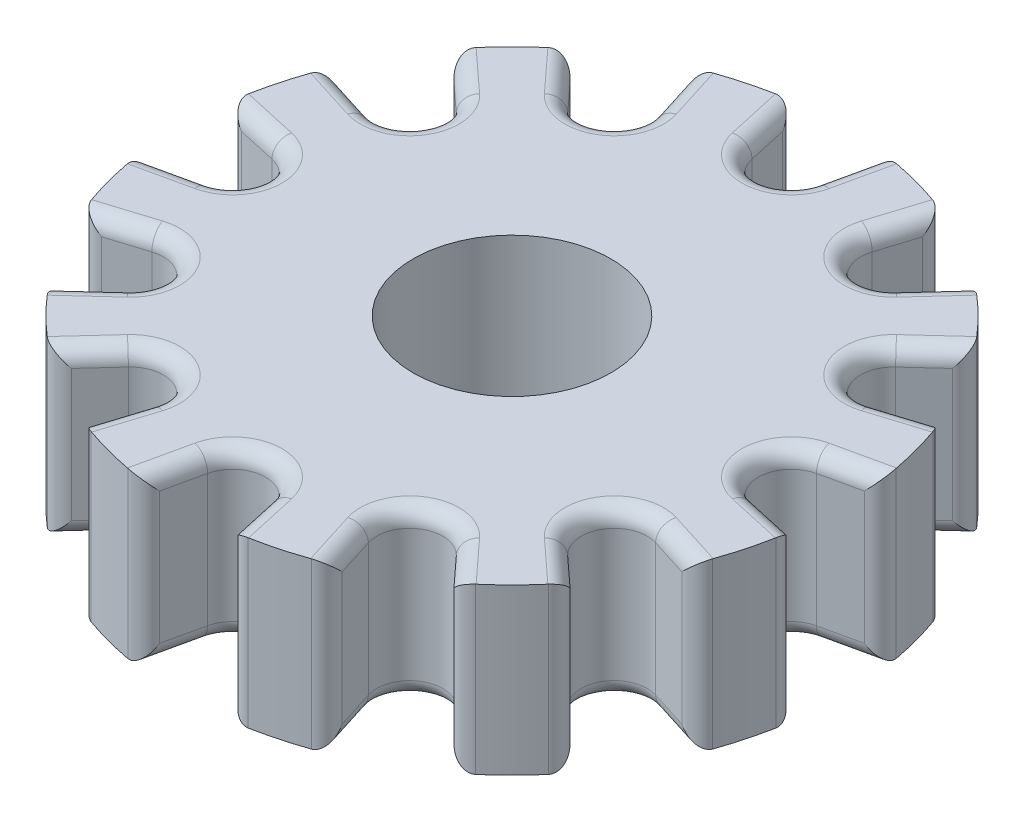
from build123d import *

# Parameters (mm, degrees)
SKETCH2_R                = 20
BOSS_EXTRUDE2_DEPTH      = 5
SKETCH4_R                = 6
CUT_EXTRUDE3_DEPTH       = 10
CUT_EXTRUDE5_DEPTH       = 10
FILLET1_R                = 1
CIRPATTERN3_COUNT        = 12
FILLET1_OF_CIRPATTERN3_R = 1


with BuildPart() as part:
    # Sketch2 → Boss-Extrude2 (new, symmetric)
    with BuildSketch(Plane(origin=(0, 0, 0), x_dir=(1, 0, 0), z_dir=(0, 1, 0))):
        with Locations(Location((0, 0, 0), (0, 0, 270))):
            Circle(SKETCH2_R)
    extrude(amount=BOSS_EXTRUDE2_DEPTH, both=True)

    # Sketch4 → Cut-Extrude3 (cut)
    with BuildSketch(Plane(origin=(0, 5, 0), x_dir=(1, 0, 0), z_dir=(0, 1, 0))):
        with Locations(Location((0, 0, 0), (0, 0, 270))):
            Circle(SKETCH4_R)
    extrude(amount=-CUT_EXTRUDE3_DEPTH, mode=Mode.SUBTRACT)

    # Sketch3 → Cut-Extrude5 (cut)
    with BuildSketch(Plane(origin=(0, 5, 0), x_dir=(1, 0, 0), z_dir=(0, 1, 0))):
        with BuildLine():
            Line((1.952478146, 16.518952502), (2.684980769, 19.818952502))
            ThreePointArc((2.684980769, 19.818952502), (0, 20), (-2.684980769, 19.818952502))
            Line((-2.684980769, 19.818952502), (-1.952478146, 16.518952502))
            ThreePointArc((-1.952478146, 16.518952502), (0, 14.952345036), (1.952478146, 16.518952502))
        make_face()
    cut_extrude5 = extrude(amount=-CUT_EXTRUDE5_DEPTH, mode=Mode.SUBTRACT)

    # Fillet1
    fillet1_edges = [part.edges().sort_by_distance(p)[0] for p in [
        (-2.684980769, 0, -19.818952502),
        (2.318729458, -5, -18.168952502),
        (2.684980769, 0, -19.818952502),
        (0, -5, -14.952345036),
        (-2.318729458, -5, -18.168952502),
        (-2.318729458, 5, -18.168952502),
        (0, 5, -14.952345036),
        (2.318729458, 5, -18.168952502),
    ]]
    fillet(fillet1_edges, radius=FILLET1_R)

    # CirPattern3: Cut-Extrude5 ×12 about axis
    cirpattern3_axis = Axis((0, 0, 0), (0, 1, 0))
    for i in range(1, CIRPATTERN3_COUNT):
        add(cut_extrude5.rotate(cirpattern3_axis, i * 360 / CIRPATTERN3_COUNT), mode=Mode.SUBTRACT)

    # Fillet1 of CirPattern3
    fillet1_of_cirpattern3_edges = [part.edges().sort_by_distance(p)[0] for p in [
        (-12.234737806, 0, -15.821225958),
        (-7.076397636, -5, -16.894139156),
        (-7.584214696, 0, -18.506206728),
        (-7.476172518, -5, -12.949110648),
        (-11.092554866, -5, -14.575409698),
        (-11.092554866, 5, -14.575409698),
        (-7.476172518, 5, -12.949110648),
        (-7.076397636, 5, -16.894139156),
        (-18.506206728, 0, -7.584214696),
        (-14.575409698, -5, -11.092554866),
        (-15.821225958, 0, -12.234737806),
        (-12.949110648, -5, -7.476172518),
        (-16.894139156, -5, -7.076397636),
        (-16.894139156, 5, -7.076397636),
        (-12.949110648, 5, -7.476172518),
        (-14.575409698, 5, -11.092554866),
        (-19.818952502, 0, 2.684980769),
        (-18.168952502, -5, -2.318729458),
        (-19.818952502, 0, -2.684980769),
        (-14.952345036, -5, 0),
        (-18.168952502, -5, 2.318729458),
        (-18.168952502, 5, 2.318729458),
        (-14.952345036, 5, 0),
        (-18.168952502, 5, -2.318729458),
        (-15.821225958, 0, 12.234737806),
        (-16.894139156, -5, 7.076397636),
        (-18.506206728, 0, 7.584214696),
        (-12.949110648, -5, 7.476172518),
        (-14.575409698, -5, 11.092554866),
        (-14.575409698, 5, 11.092554866),
        (-12.949110648, 5, 7.476172518),
        (-16.894139156, 5, 7.076397636),
        (-7.584214696, 0, 18.506206728),
        (-11.092554866, -5, 14.575409698),
        (-12.234737806, 0, 15.821225958),
        (-7.476172518, -5, 12.949110648),
        (-7.076397636, -5, 16.894139156),
        (-7.076397636, 5, 16.894139156),
        (-7.476172518, 5, 12.949110648),
        (-11.092554866, 5, 14.575409698),
        (2.684980769, 0, 19.818952502),
        (-2.318729458, -5, 18.168952502),
        (-2.684980769, 0, 19.818952502),
        (0, -5, 14.952345036),
        (2.318729458, -5, 18.168952502),
        (2.318729458, 5, 18.168952502),
        (0, 5, 14.952345036),
        (-2.318729458, 5, 18.168952502),
        (12.234737806, 0, 15.821225958),
        (7.076397636, -5, 16.894139156),
        (7.584214696, 0, 18.506206728),
        (7.476172518, -5, 12.949110648),
        (11.092554866, -5, 14.575409698),
        (11.092554866, 5, 14.575409698),
        (7.476172518, 5, 12.949110648),
        (7.076397636, 5, 16.894139156),
        (18.506206728, 0, 7.584214696),
        (14.575409698, -5, 11.092554866),
        (15.821225958, 0, 12.234737806),
        (12.949110648, -5, 7.476172518),
        (16.894139156, -5, 7.076397636),
        (16.894139156, 5, 7.076397636),
        (12.949110648, 5, 7.476172518),
        (14.575409698, 5, 11.092554866),
        (19.818952502, 0, -2.684980769),
        (18.168952502, -5, 2.318729458),
        (19.818952502, 0, 2.684980769),
        (14.952345036, -5, 0),
        (18.168952502, -5, -2.318729458),
        (18.168952502, 5, -2.318729458),
        (14.952345036, 5, 0),
        (18.168952502, 5, 2.318729458),
        (15.821225958, 0, -12.234737806),
        (16.894139156, -5, -7.076397636),
        (18.506206728, 0, -7.584214696),
        (12.949110648, -5, -7.476172518),
        (14.575409698, -5, -11.092554866),
        (14.575409698, 5, -11.092554866),
        (12.949110648, 5, -7.476172518),
        (16.894139156, 5, -7.076397636),
        (7.584214696, 0, -18.506206728),
        (11.092554866, -5, -14.575409698),
        (12.234737806, 0, -15.821225958),
        (7.476172518, -5, -12.949110648),
        (7.076397636, -5, -16.894139156),
        (7.076397636, 5, -16.894139156),
        (7.476172518, 5, -12.949110648),
        (11.092554866, 5, -14.575409698),
    ]]
    fillet(fillet1_of_cirpattern3_edges, radius=FILLET1_OF_CIRPATTERN3_R)


solid = part.part
